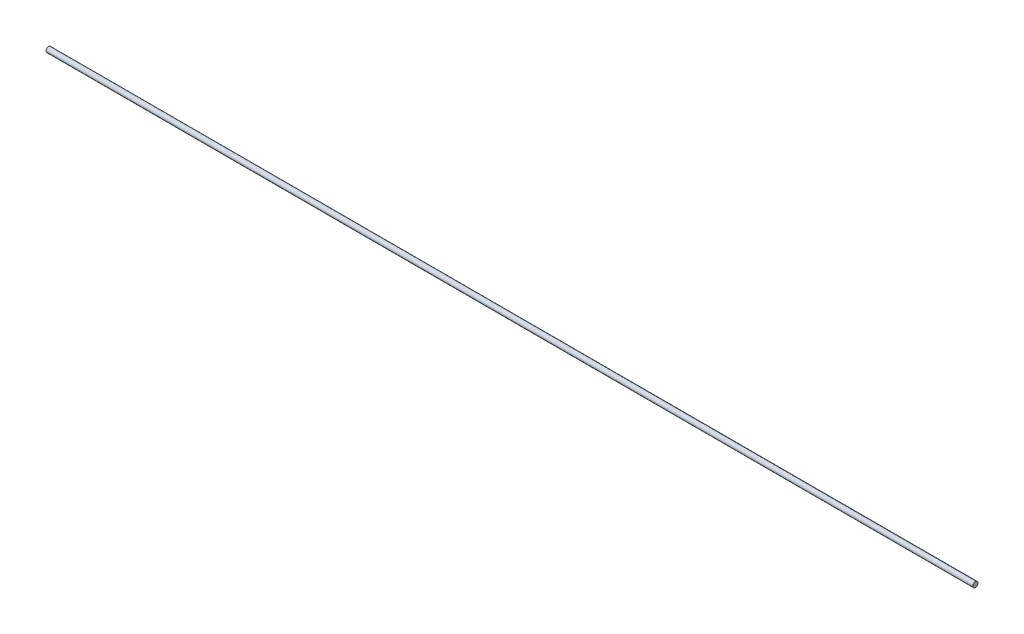
from build123d import *

# Parameters (mm, degrees)
SKETCH1_R           = 3
BOSS_EXTRUDE1_DEPTH = 1080


with BuildPart() as part:
    # Sketch1 → Boss-Extrude1 (new body)
    with BuildSketch(Plane(origin=(0, 0, 0), x_dir=(0, 0, -1), z_dir=(1, 0, 0))):
        Circle(SKETCH1_R)
    extrude(amount=BOSS_EXTRUDE1_DEPTH)


solid = part.part
